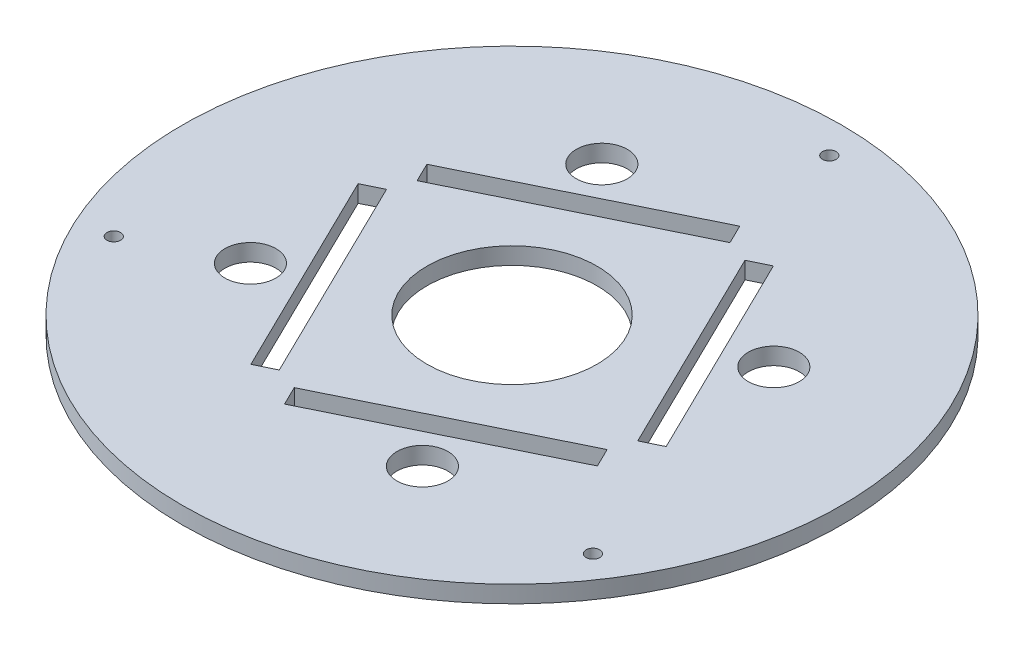
from build123d import *

# Parameters (mm, degrees)
SKETCH_1_R               = 77.5
SKETCH_1_R_2             = 1.6
EXTRUDE_1_DEPTH          = 4
CUT_EXTRUDE_2_DEPTH      = 110.674518463
CUT_EXTRUDE_2_DEPTH_BACK = 110.674518463
SKETCH_3_R               = 20
CUT_EXTRUDE_3_DEPTH      = 110.674518463
CUT_EXTRUDE_3_DEPTH_BACK = 110.674518463
SKETCH_4_R               = 6


with BuildPart() as part:
    # 草图1 → 凸台-拉伸1 (new body)
    with BuildSketch(Plane(origin=(0, 0, 0), x_dir=(1, 0, 0), z_dir=(0, 1, 0))):
        with Locations(Location((0, 0, 0), (0, 0, 270))):
            Circle(SKETCH_1_R)
        with Locations(Location((4.784441198, 69.836302325, 0), (0, 0, 270))):
            Circle(SKETCH_1_R_2, mode=Mode.SUBTRACT)
        with Locations(Location((-62.872232519, -30.774703542, 0), (0, 0, 270))):
            Circle(SKETCH_1_R_2, mode=Mode.SUBTRACT)
        with Locations(Location((58.087791321, -39.061598783, 0), (0, 0, 270))):
            Circle(SKETCH_1_R_2, mode=Mode.SUBTRACT)
    extrude(amount=EXTRUDE_1_DEPTH)

    # 草图3 → 切除-拉伸2 (cut, two sides: drawn at the far end of the back side and taken through both)
    with BuildSketch(Plane(origin=(0, 4, 0), x_dir=(1, 0, 0), z_dir=(0, 1, 0)).offset(-CUT_EXTRUDE_2_DEPTH_BACK)):
        with Locations(Location((0, 0, 0), (0, 0, 270))):
            Circle(SKETCH_3_R)
    extrude(amount=CUT_EXTRUDE_2_DEPTH + CUT_EXTRUDE_2_DEPTH_BACK, mode=Mode.SUBTRACT)

    # 草图4 → 切除-拉伸3 (cut, two sides: drawn at the far end of the back side and taken through both)
    with BuildSketch(Plane.XZ.offset(-CUT_EXTRUDE_3_DEPTH_BACK)):
        with Locations(Location((-41.314039797, 20.194571008, 0), (0, 0, 270))):
            Circle(SKETCH_4_R)
        Polygon((-20.69437357, 40.719305585), (-44.874497782, -8.680305679), (-40.383624031, -10.87849879), (-16.203499819, 38.521112475), align=None)
        Polygon((-10.847694468, 40.35681714), (13.852111164, 28.266755034), (16.050304274, 32.757628786), (-8.649501358, 44.847690892), align=None)
        with Locations(Location((20.225375329, 41.287232906, 0), (0, 0, 270))):
            Circle(SKETCH_4_R)
        Polygon((13.852111164, 28.266755034), (38.551916796, 16.176692928), (40.750109907, 20.66756668), (16.050304274, 32.757628786), align=None)
        Polygon((20.698371001, -40.776916797), (44.878495213, 8.622694468), (40.387621462, 10.820887578), (16.20749725, -38.578723687), align=None)
        with Locations(Location((41.318037228, -20.252182219, 0), (0, 0, 270))):
            Circle(SKETCH_4_R)
        Polygon((-40.746112475, -20.725177891), (8.653498789, -44.905302103), (10.851691899, -40.414428352), (-38.547919365, -16.23430414), align=None)
        with Locations(Location((-20.221377898, -41.344844118, 0), (0, 0, 270))):
            Circle(SKETCH_4_R)
    extrude(amount=CUT_EXTRUDE_3_DEPTH + CUT_EXTRUDE_3_DEPTH_BACK, mode=Mode.SUBTRACT)


solid = part.part
